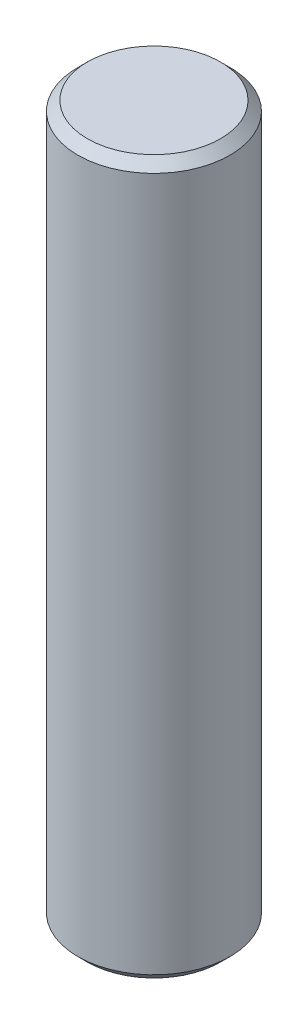
from build123d import *

# Parameters (mm, degrees)
SKETCH1_R           = 16
BOSS_EXTRUDE1_DEPTH = 150
CHAMFER1_SIZE       = 2


with BuildPart() as part:
    # Sketch1 → Boss-Extrude1 (new body)
    with BuildSketch(Plane(origin=(0, 0, 0), x_dir=(1, 0, 0), z_dir=(0, 1, 0))):
        with Locations(Location((0, 0, 0), (0, 0, 270))):
            Circle(SKETCH1_R)
    extrude(amount=BOSS_EXTRUDE1_DEPTH)

    # Chamfer1
    chamfer1_edges = [part.edges().sort_by_distance(p)[0] for p in [
        (0, 0, -16),
        (0, 150, -16),
    ]]
    chamfer(chamfer1_edges, length=CHAMFER1_SIZE)


solid = part.part
